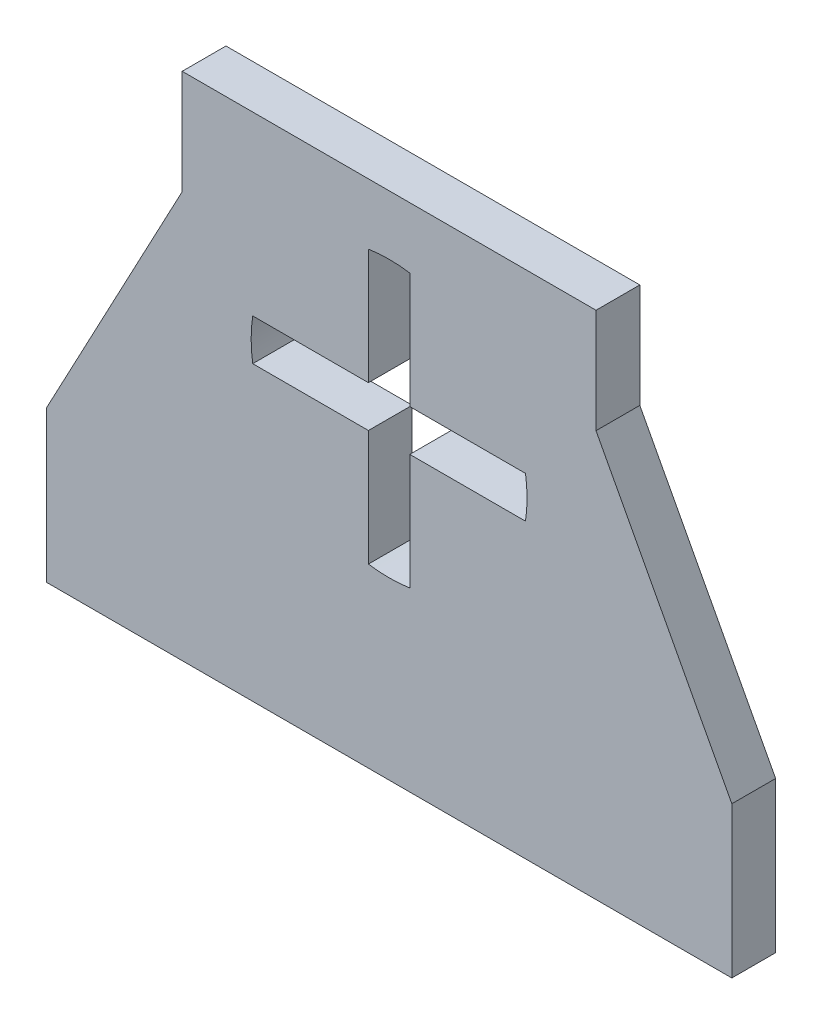
from build123d import *

# Parameters (mm, degrees)
SKETCH1_W           = 49.69
SKETCH1_H           = 27
BOSS_EXTRUDE1_DEPTH = 3.175
CUT_EXTRUDE1_DEPTH  = 3.175
BOSS_EXTRUDE2_DEPTH = 3.175
BOSS_EXTRUDE3_DEPTH = 3.175
CUT_EXTRUDE2_DEPTH  = 3.175
CUT_EXTRUDE3_DEPTH  = 3.175


with BuildPart() as part:
    # Sketch1 → Boss-Extrude1 (new body)
    with BuildSketch(Plane.XY):
        Rectangle(SKETCH1_W, SKETCH1_H)
    extrude(amount=BOSS_EXTRUDE1_DEPTH)

    # Sketch2 → Cut-Extrude1 (cut)
    with BuildSketch(Plane.XY):
        Polygon((10, 6.75), (24.845, -6.75), (24.845, 0), (24.845, 13.5), (10, 13.5), align=None)
        Polygon((-24.845, 13.5), (-24.845, -6.75), (-10, 6.75), (-10, 13.5), align=None)
    extrude(amount=CUT_EXTRUDE1_DEPTH, mode=Mode.SUBTRACT)

    # Sketch3 → Boss-Extrude2 (add)
    with BuildSketch(Plane(origin=(0, 0, 0), x_dir=(-1, 0, 0), z_dir=(0, 0, -1))):
        with BuildLine():
            Line((-24.845, -2.5625), (-24.845, -6.75))
            Line((-24.845, -6.75), (-10, 6.75))
            Line((-10, 6.75), (-10, 13.5))
            Line((-10, 13.5), (-9.028288874, 13.5))
            ThreePointArc((-9.028288874, 13.5), (0, 19.2), (9.028288874, 13.5))
            Line((9.028288874, 13.5), (10, 13.5))
            Line((10, 13.5), (10, 6.75))
            Line((10, 6.75), (24.845, -6.75))
            Line((24.845, -6.75), (24.845, -2.5625))
            Line((24.845, -2.5625), (15, 15.9375))
            Line((15, 15.9375), (15, 23.5))
            Line((15, 23.5), (-15, 23.5))
            Line((-15, 23.5), (-15, 15.9375))
            Line((-15, 15.9375), (-24.845, -2.5625))
        make_face()
    extrude(amount=-BOSS_EXTRUDE2_DEPTH)

    # Sketch4 → Boss-Extrude3 (add)
    # profile 1 of 2: a face of its own
    with BuildSketch(Plane(origin=(0, 0, 0), x_dir=(-1, 0, 0), z_dir=(0, 0, -1))):
        Polygon((-24.845, -2.5625), (-24.845, -13.5), (0, -13.5), (24.845, -13.5), (24.845, -2.5625), (15, 15.9375), (15, 23.5), (-15, 23.5), (-15, 15.9375), align=None)
        with BuildLine():
            ThreePointArc((10, 9.2), (7.071067812, 2.128932188), (0, -0.8))
            ThreePointArc((0, -0.8), (-8.455767263, 3.861460874), (-9.028288874, 13.5))
            ThreePointArc((-9.028288874, 13.5), (0, 19.2), (9.028288874, 13.5))
            ThreePointArc((9.028288874, 13.5), (9.754047589, 11.404213154), (10, 9.2))
        make_face(mode=Mode.SUBTRACT)
    # profile 2 of 2: a face of its own
    with BuildSketch(Plane(origin=(0, 0, 0), x_dir=(-1, 0, 0), z_dir=(0, 0, -1))):
        with BuildLine():
            ThreePointArc((-9.028288874, 13.5), (0, 19.2), (9.028288874, 13.5))
            Line((9.028288874, 13.5), (-9.028288874, 13.5))
        make_face()
    extrude(amount=-BOSS_EXTRUDE3_DEPTH)

    # Sketch5 → Cut-Extrude2 (cut)
    with BuildSketch(Plane(origin=(0, 0, 0), x_dir=(-1, 0, 0), z_dir=(0, 0, -1))):
        with BuildLine():
            Line((9.949874371, 10.2), (1, 10.2))
            Line((1, 10.2), (1, 19.149874371))
            ThreePointArc((1, 19.149874371), (0, 19.2), (-1, 19.149874371))
            Line((-1, 19.149874371), (-1, 10.2))
            Line((-1, 10.2), (-9.949874371, 10.2))
            ThreePointArc((-9.949874371, 10.2), (-10, 9.2), (-9.949874371, 8.2))
            Line((-9.949874371, 8.2), (-1, 8.2))
            Line((-1, 8.2), (-1, -0.749874371))
            ThreePointArc((-1, -0.749874371), (-0.500627751, -0.787460731), (0, -0.8))
            ThreePointArc((0, -0.8), (0.500627751, -0.787460731), (1, -0.749874371))
            Line((1, -0.749874371), (1, 8.2))
            Line((1, 8.2), (9.949874371, 8.2))
            ThreePointArc((9.949874371, 8.2), (9.987460731, 8.699372249), (10, 9.2))
            ThreePointArc((10, 9.2), (9.987460731, 9.700627751), (9.949874371, 10.2))
        make_face()
    extrude(amount=-CUT_EXTRUDE2_DEPTH, mode=Mode.SUBTRACT)

    # Sketch6 → Cut-Extrude3 (cut)
    with BuildSketch(Plane(origin=(0, 0, 0), x_dir=(-1, 0, 0), z_dir=(0, 0, -1))):
        with BuildLine():
            Line((1.5, 10.7), (1.5, 19.086859967))
            ThreePointArc((1.5, 19.086859967), (1.250397018, 19.121517389), (1, 19.149874371))
            Line((1, 19.149874371), (1, 10.2))
            Line((1, 10.2), (9.949874371, 10.2))
            ThreePointArc((9.949874371, 10.2), (9.921517389, 10.450397018), (9.886859967, 10.7))
            Line((9.886859967, 10.7), (1.5, 10.7))
        make_face()
        with BuildLine():
            Line((-1, 10.2), (-1, 19.149874371))
            ThreePointArc((-1, 19.149874371), (-1.250397018, 19.121517389), (-1.5, 19.086859967))
            Line((-1.5, 19.086859967), (-1.5, 10.7))
            Line((-1.5, 10.7), (-9.886859967, 10.7))
            ThreePointArc((-9.886859967, 10.7), (-9.921517389, 10.450397018), (-9.949874371, 10.2))
            Line((-9.949874371, 10.2), (-1, 10.2))
        make_face()
        with BuildLine():
            ThreePointArc((9.886859967, 7.7), (9.921517389, 7.949602982), (9.949874371, 8.2))
            Line((9.949874371, 8.2), (1, 8.2))
            Line((1, 8.2), (1, -0.749874371))
            ThreePointArc((1, -0.749874371), (1.250397018, -0.721517389), (1.5, -0.686859967))
            Line((1.5, -0.686859967), (1.5, 7.7))
            Line((1.5, 7.7), (9.886859967, 7.7))
        make_face()
        with BuildLine():
            Line((-1, -0.749874371), (-1, 8.2))
            Line((-1, 8.2), (-9.949874371, 8.2))
            ThreePointArc((-9.949874371, 8.2), (-9.921517389, 7.949602982), (-9.886859967, 7.7))
            Line((-9.886859967, 7.7), (-1.5, 7.7))
            Line((-1.5, 7.7), (-1.5, -0.686859967))
            ThreePointArc((-1.5, -0.686859967), (-1.250397018, -0.721517389), (-1, -0.749874371))
        make_face()
    extrude(amount=-CUT_EXTRUDE3_DEPTH, mode=Mode.SUBTRACT)


solid = part.part
